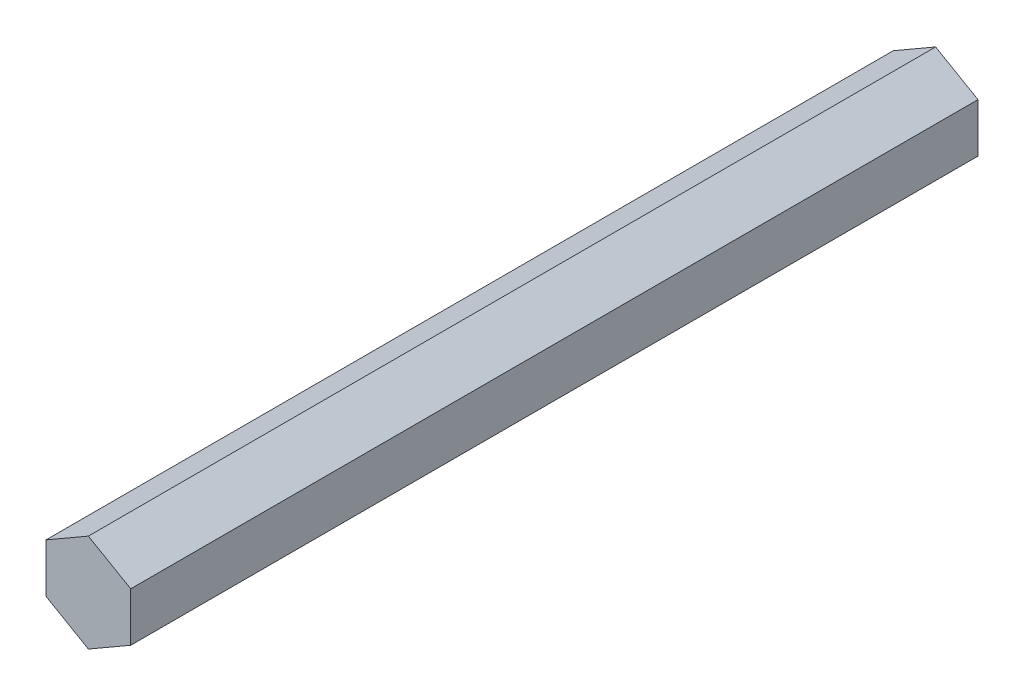
from build123d import *

# Parameters (mm, degrees)
BOSS_EXTRUDE3_DEPTH = 127


with BuildPart() as part:
    # Sketch1<3> → Boss-Extrude3 (new body)
    with BuildSketch(Plane.XY):
        Polygon((6.35, -3.666174209), (6.35, 3.666174209), (0, 7.332348419), (-6.35, 3.666174209), (-6.35, -3.666174209), (0, -7.332348419), align=None)
    extrude(amount=BOSS_EXTRUDE3_DEPTH)


solid = part.part
